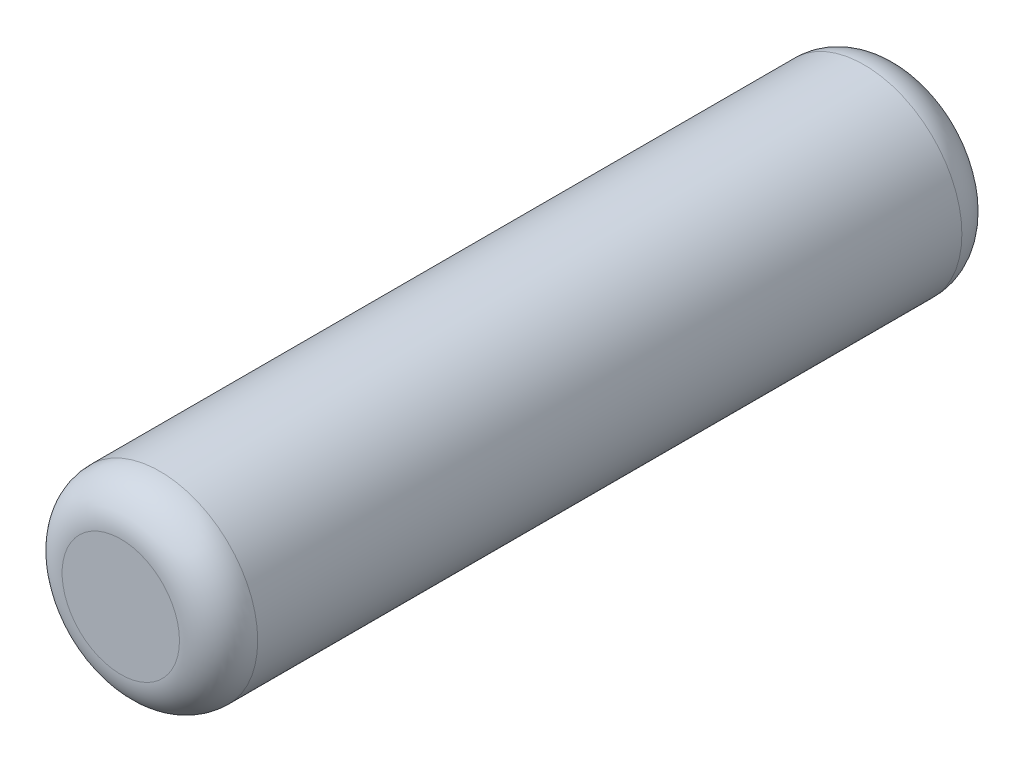
from build123d import *

# Parameters (mm, degrees)
SKETCH1_R           = 2.5
BOSS_EXTRUDE1_DEPTH = 20
FILLET1_R           = 1


with BuildPart() as part:
    # Sketch1 → Boss-Extrude1 (new body)
    with BuildSketch(Plane.XY):
        Circle(SKETCH1_R)
    extrude(amount=BOSS_EXTRUDE1_DEPTH)

    # Fillet1
    fillet1_edges = [part.edges().sort_by_distance(p)[0] for p in [
        (-2.5, 0, 0),
        (-2.5, 0, 20),
    ]]
    fillet(fillet1_edges, radius=FILLET1_R)


solid = part.part
